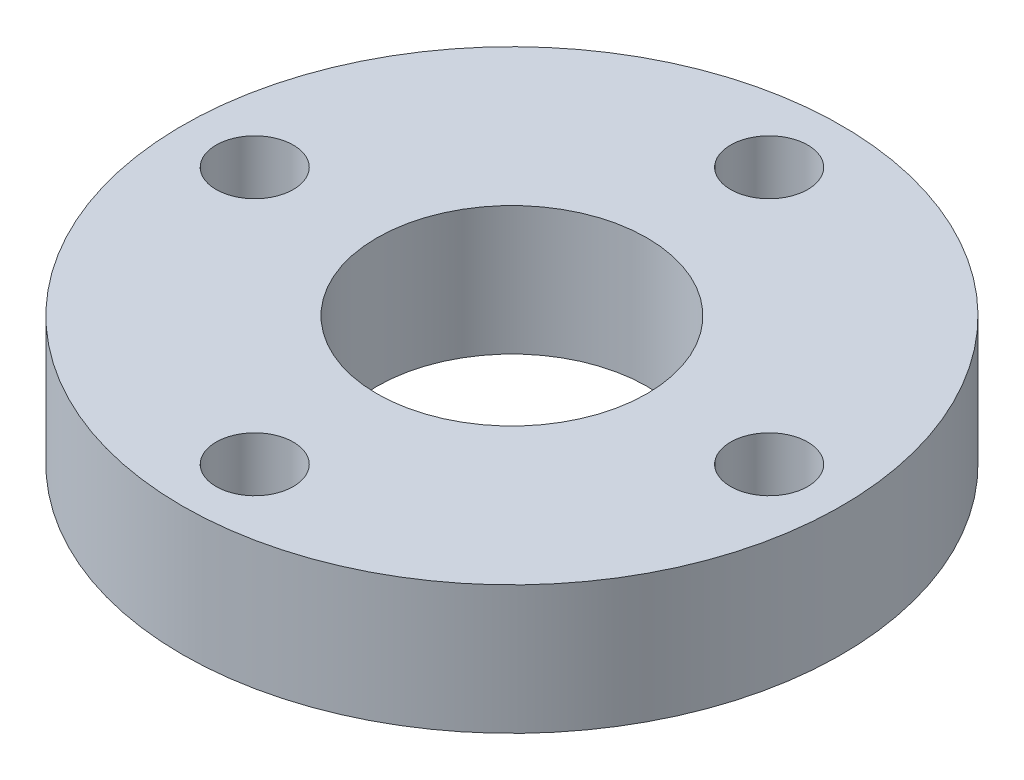
from build123d import *

# Parameters (mm, degrees)
SKETCH1_R           = 10.25
SKETCH1_R_2         = 4.2
SKETCH1_R_3         = 1.2
BOSS_EXTRUDE1_DEPTH = 4


with BuildPart() as part:
    # Sketch1 → Boss-Extrude1 (new body)
    with BuildSketch(Plane(origin=(0, 0, 0), x_dir=(1, 0, 0), z_dir=(0, 1, 0))):
        with Locations(Location((0, 0, 0), (0, 0, 270))):
            Circle(SKETCH1_R)
        with Locations(Location((0, 0, 0), (0, 0, 270))):
            Circle(SKETCH1_R_2, mode=Mode.SUBTRACT)
        with Locations(Location((0, 8, 0), (0, 0, 270))):
            Circle(SKETCH1_R_3, mode=Mode.SUBTRACT)
        with Locations(Location((8, 0, 0), (0, 0, 270))):
            Circle(SKETCH1_R_3, mode=Mode.SUBTRACT)
        with Locations(Location((0, -8, 0), (0, 0, 270))):
            Circle(SKETCH1_R_3, mode=Mode.SUBTRACT)
        with Locations(Location((-8, 0, 0), (0, 0, 270))):
            Circle(SKETCH1_R_3, mode=Mode.SUBTRACT)
    extrude(amount=BOSS_EXTRUDE1_DEPTH)


solid = part.part
